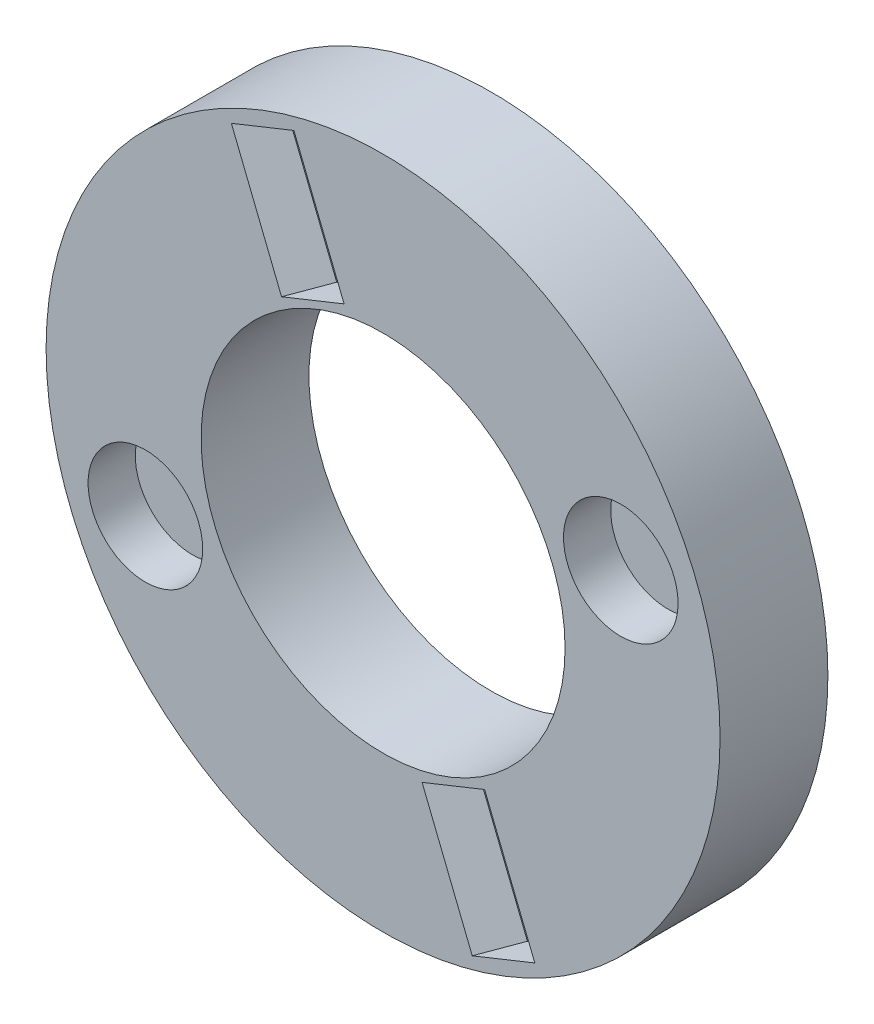
from build123d import *

# Parameters (mm, degrees)
ESQUISSE1_R              = 25
ESQUISSE1_R_2            = 11
BOSS_EXTRU_1_DEPTH       = 8
ENL_V_START              = -14
ENL_V_MAT_EXTRU_9_DEPTH  = 10
ESQUISSE10_R             = 4.25
ENL_V_MAT_EXTRU_5_DEPTH  = 3.5
ESQUISSE12_R             = 4.25
ENL_V_MAT_EXTRU_6_DEPTH  = 3.5
ESQUISSE13_R             = 13.5
ENL_V_MAT_EXTRU_7_DEPTH  = 10
ENL_V_MAT_EXTRU_10_DEPTH = 10


with BuildPart() as part:
    # Esquisse1 → Boss.-Extru.1 (new body)
    with BuildSketch(Plane.XY):
        Circle(ESQUISSE1_R)
        Circle(ESQUISSE1_R_2, mode=Mode.SUBTRACT)
    extrude(amount=BOSS_EXTRU_1_DEPTH)

    # Esquisse16 → Enlèv. mat.-Extru.9 (cut)
    with BuildSketch(Plane(origin=(0, 0, 0), x_dir=(-0.9281017411356184, -0.3723266819622707, 0), z_dir=(-0.3723266819622707, 0.9281017411356184, 0)).offset(ENL_V_START)):
        Polygon((-2.5, 8), (2.5, 8), (0.5, 5.763932023), (-0.5, 5.763932023), align=None)
    enl_v_mat_extru_9 = extrude(amount=-ENL_V_MAT_EXTRU_9_DEPTH, mode=Mode.SUBTRACT)

    # Symétrie4: Enlèv. mat.-Extru.9 across plane
    add(enl_v_mat_extru_9.mirror(Plane(origin=(0, 0, 0), x_dir=(0, 0, 1), z_dir=(-0.3723266819622707, 0.9281017411356184, 0))), mode=Mode.SUBTRACT)

    # Esquisse10 → Enlèv. mat.-Extru.5 (cut)
    with BuildSketch(Plane(origin=(0, 0, 0), x_dir=(-1, 0, 0), z_dir=(0, 0, -1))):
        with Locations((7.074206957, 17.633933082)):
            Circle(ESQUISSE10_R)
        with Locations((-7.074206957, -17.633933082)):
            Circle(ESQUISSE10_R)
    extrude(amount=-ENL_V_MAT_EXTRU_5_DEPTH, mode=Mode.SUBTRACT)

    # Esquisse12 → Enlèv. mat.-Extru.6 (cut)
    with BuildSketch(Plane.XY.offset(8)):
        with Locations((17.633933082, 7.074206957)):
            Circle(ESQUISSE12_R)
        with Locations((-17.633933082, -7.074206957)):
            Circle(ESQUISSE12_R)
    extrude(amount=-ENL_V_MAT_EXTRU_6_DEPTH, mode=Mode.SUBTRACT)

    # Esquisse13 → Enlèv. mat.-Extru.7 (cut)
    with BuildSketch(Plane.XY.offset(8)):
        Circle(ESQUISSE13_R)
    extrude(amount=-ENL_V_MAT_EXTRU_7_DEPTH, mode=Mode.SUBTRACT)

    # Esquisse18 → Enlèv. mat.-Extru.10 (cut)
    with BuildSketch(Plane(origin=(0, 0, 8), x_dir=(0, 0, 1), z_dir=(-0.9281017411356183, -0.37232668196227087, 0)).offset(ENL_V_START)):
        Polygon((-8, -2.5), (-8, 2.5), (-5.763932023, 0.5), (-5.763932023, -0.5), align=None)
    enl_v_mat_extru_10 = extrude(amount=-ENL_V_MAT_EXTRU_10_DEPTH, mode=Mode.SUBTRACT)

    # Symétrie5: Enlèv. mat.-Extru.10 across plane
    add(enl_v_mat_extru_10.mirror(Plane(origin=(0, 0, 8), x_dir=(0, 0, 1), z_dir=(-0.9281017411356183, -0.37232668196227087, 0))), mode=Mode.SUBTRACT)


solid = part.part
